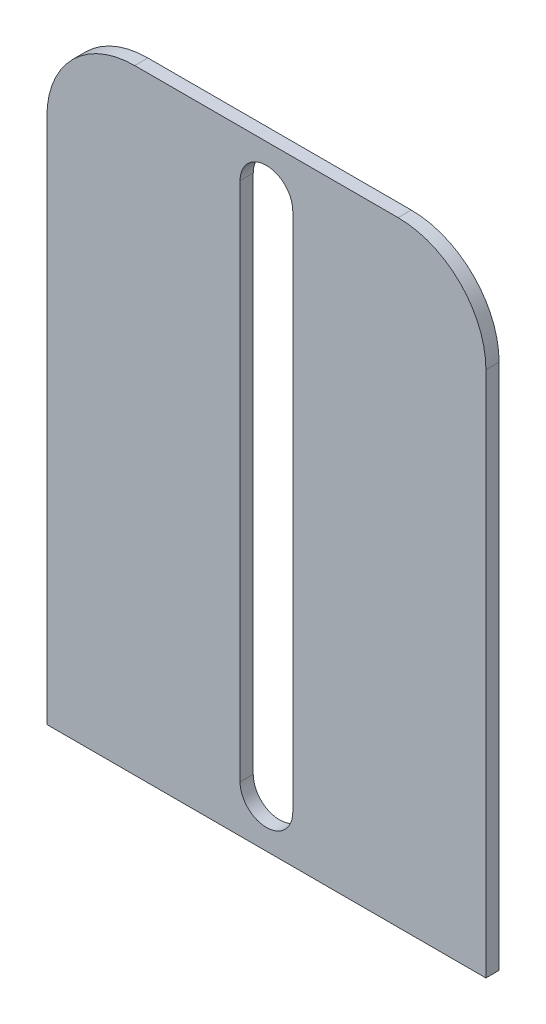
from build123d import *

# Parameters (mm, degrees)
SKETCH1_W           = 50
SKETCH1_H           = 70
BOSS_EXTRUDE1_DEPTH = 1.5
FILLET1_R           = 10


with BuildPart() as part:
    # Sketch1 → Boss-Extrude1 (new body)
    with BuildSketch(Plane.XY):
        Rectangle(SKETCH1_W, SKETCH1_H)
        with BuildLine():
            Line((-3, -29.653280585), (-3, 29.653280585))
            ThreePointArc((-3, 29.653280585), (0, 32.653280585), (3, 29.653280585))
            Line((3, 29.653280585), (3, -29.653280585))
            ThreePointArc((3, -29.653280585), (0, -32.653280585), (-3, -29.653280585))
        make_face(mode=Mode.SUBTRACT)
    extrude(amount=BOSS_EXTRUDE1_DEPTH)

    # Fillet1
    fillet1_edges = [part.edges().sort_by_distance(p)[0] for p in [
        (-25, 35, 0.75),
        (25, 35, 0.75),
    ]]
    fillet(fillet1_edges, radius=FILLET1_R)


solid = part.part
